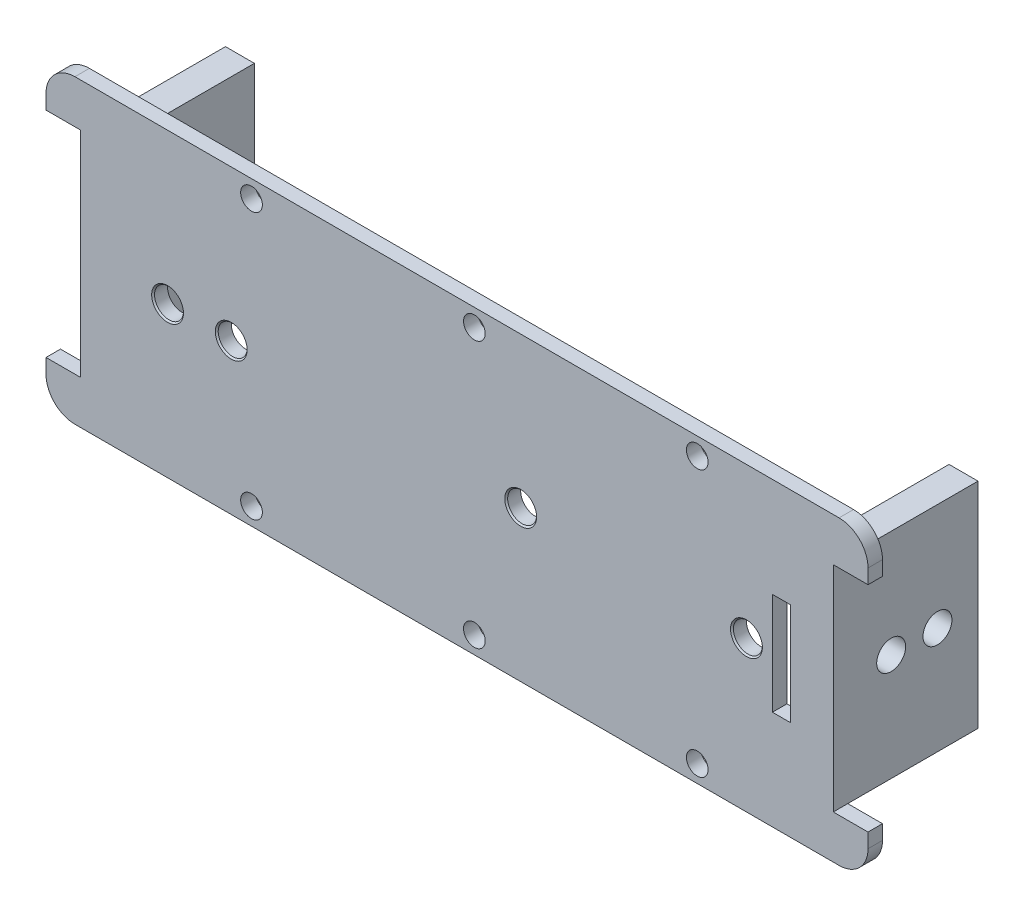
from build123d import *

# Parameters (mm, degrees)
SKETCH1_4_W                            = 360.68
SKETCH1_4_H                            = 132.08
SKETCH1_4_W_2                          = 27.94
SKETCH1_4_H_2                          = 93.98
BOSS_EXTRUDE3_DEPTH                    = 6.35
F_3_8_0_375_DIAMETER_HOLE1_D           = 9.525
F_3_8_0_375_DIAMETER_HOLE1_DEPTH       = 12.7
F_3_8_0_375_DIAMETER_HOLE1_CSINK_D     = 10.795
F_3_8_0_375_DIAMETER_HOLE1_CSINK_ANGLE = 90
F_3_8_0_375_DIAMETER_HOLE1_TIP         = 2.861598698
FILLET1_R                              = 12.7
SKETCH1_W                              = 27.94
SKETCH1_H                              = 93.98
BOSS_EXTRUDE4_DEPTH                    = 63.5
SKETCH10_R                             = 10.16
SKETCH10_R_2                           = 6.35
CUT_EXTRUDE11_DEPTH                    = 386.08
FILLET5_R                              = 6.35
F_1_2_0_5_DIAMETER_HOLE1_D             = 12.7
F_1_2_0_5_DIAMETER_HOLE1_DEPTH         = 13.97
F_1_2_0_5_DIAMETER_HOLE1_CSINK_D       = 13.97
F_1_2_0_5_DIAMETER_HOLE1_CSINK_ANGLE   = 90
F_1_2_0_5_DIAMETER_HOLE1_TIP           = 3.815464931
THREAD15_PITCH                         = 2.116666667
THREAD15_HEIGHT                        = 10
THREAD15_RADIUS                        = 10.16
THREAD15_START_ANGLE                   = -180
SKETCH25_W                             = 7.837170734
SKETCH25_H                             = 44.791396978
CUT_EXTRUDE12_DEPTH                    = 36.068
THREAD16_PITCH                         = 2.116666667
THREAD16_HEIGHT                        = 10
THREAD16_RADIUS                        = 10.16
THREAD16_START_ANGLE                   = -180
BOSS_EXTRUDE6_START                    = -15.24
SKETCH28_R                             = 10.16
BOSS_EXTRUDE6_DEPTH                    = 15.24
SKETCH29_R                             = 10.16
BOSS_EXTRUDE7_DEPTH                    = 15.24
SKETCH30_W                             = 15.24
SKETCH30_H                             = 93.98
CUT_EXTRUDE13_DEPTH                    = 57.15
SKETCH30_2_W                           = 15.24
SKETCH30_2_H                           = 93.98
CUT_EXTRUDE15_DEPTH                    = 139.954
SKETCH33_R                             = 6.35
CUT_EXTRUDE16_DEPTH                    = 343.916


with BuildPart() as part:
    # Sketch1<4> → Boss-Extrude3 (new body)
    with BuildSketch(Plane.XY):
        with Locations((180.34, 66.04)):
            Rectangle(SKETCH1_4_W, SKETCH1_4_H)
        with Locations((346.71, 66.04)):
            Rectangle(SKETCH1_4_W_2, SKETCH1_4_H_2)
    extrude(amount=-BOSS_EXTRUDE3_DEPTH)

    # 3/8 (0.375) Diameter Hole1
    with Locations(Plane.XY.offset(6.35)):
        with Locations((187.96, 124.46), (285.75, 124.46), (90.17, 124.46), (90.17, 7.62), (187.96, 7.62), (285.75, 7.62)):
            CounterSinkHole(F_3_8_0_375_DIAMETER_HOLE1_D / 2, F_3_8_0_375_DIAMETER_HOLE1_CSINK_D / 2, depth=F_3_8_0_375_DIAMETER_HOLE1_DEPTH, counter_sink_angle=F_3_8_0_375_DIAMETER_HOLE1_CSINK_ANGLE)
            with Locations((0, 0, -(F_3_8_0_375_DIAMETER_HOLE1_DEPTH + F_3_8_0_375_DIAMETER_HOLE1_TIP / 2))):  # 118° drill point
                Cone(0, F_3_8_0_375_DIAMETER_HOLE1_D / 2, F_3_8_0_375_DIAMETER_HOLE1_TIP, mode=Mode.SUBTRACT)

    # Fillet1
    fillet1_edges = [part.edges().sort_by_distance(p)[0] for p in [
        (0, 0, -3.175),
        (0, 132.08, -3.175),
        (360.68, 132.08, -3.175),
        (360.68, 0, -3.175),
    ]]
    fillet(fillet1_edges, radius=FILLET1_R)

    # Sketch1 → Boss-Extrude4 (add)
    with BuildSketch(Plane.XY):
        with Locations((346.71, 66.04)):
            Rectangle(SKETCH1_W, SKETCH1_H)
        with Locations((13.97, 66.04)):
            Rectangle(SKETCH1_W, SKETCH1_H)
    extrude(amount=-BOSS_EXTRUDE4_DEPTH)

    # Sketch10 → Cut-Extrude11 (cut)
    with BuildSketch(Plane(origin=(360.68, 0, 0), x_dir=(0, 0, -1), z_dir=(1, 0, 0))):
        with Locations((45.72, 66.04)):
            Circle(SKETCH10_R)
        with Locations((25.4, 66.04)):
            Circle(SKETCH10_R_2)
    extrude(amount=-CUT_EXTRUDE11_DEPTH, mode=Mode.SUBTRACT)

    # Fillet5
    fillet5_edges = [part.edges().sort_by_distance(p)[0] for p in [
        (360.68, 113.03, -34.925),
        (360.68, 66.04, -63.5),
        (360.68, 19.05, -34.925),
        (0, 113.03, -34.925),
        (0, 19.05, -34.925),
        (0, 66.04, -63.5),
    ]]
    fillet(fillet5_edges, radius=FILLET5_R)

    # 1/2 (0.5) Diameter Hole1
    with Locations(Plane.XY):
        with Locations((208.28, 66.04), (81.28, 66.04), (53.34, 66.04), (307.34, 66.04)):
            CounterSinkHole(F_1_2_0_5_DIAMETER_HOLE1_D / 2, F_1_2_0_5_DIAMETER_HOLE1_CSINK_D / 2, depth=F_1_2_0_5_DIAMETER_HOLE1_DEPTH, counter_sink_angle=F_1_2_0_5_DIAMETER_HOLE1_CSINK_ANGLE)
            with Locations((0, 0, -(F_1_2_0_5_DIAMETER_HOLE1_DEPTH + F_1_2_0_5_DIAMETER_HOLE1_TIP / 2))):  # 118° drill point
                Cone(0, F_1_2_0_5_DIAMETER_HOLE1_D / 2, F_1_2_0_5_DIAMETER_HOLE1_TIP, mode=Mode.SUBTRACT)

    # Thread15: sweep along a helix
    with BuildLine() as thread15_path:
        add(Helix(THREAD15_PITCH, THREAD15_HEIGHT, THREAD15_RADIUS, center=(360.68, 66.04, -45.72), direction=(-1, 0, 0), mode=Mode.PRIVATE).rotate(Axis((360.68, 66.04, -45.72), (-1, 0, 0)), THREAD15_START_ANGLE))
    # Thread Profile13 → Thread15 (sweep)
    with BuildSketch(Plane(origin=(360.68, 66.04, -35.56), x_dir=(0, 0, 1), z_dir=(0, -1, 0))):
        Polygon((0, 0), (0, 1.852083328), (-1.145679435, 1.190624997), (-1.145679435, 0.66145833), align=None)
    sweep(path=thread15_path.line, is_frenet=True)

    # Sketch25 → Cut-Extrude12 (cut)
    with BuildSketch(Plane(origin=(0, 0, -6.35), x_dir=(-1, 0, 0), z_dir=(0, 0, -1))):
        with Locations((-322.656094919, 66.002101848)):
            Rectangle(SKETCH25_W, SKETCH25_H)
    extrude(amount=-CUT_EXTRUDE12_DEPTH, mode=Mode.SUBTRACT)

    # Thread16: sweep along a helix
    with BuildLine() as thread16_path:
        add(Helix(THREAD16_PITCH, THREAD16_HEIGHT, THREAD16_RADIUS, center=(0, 66.04, -45.72), direction=(1, 0, 0), mode=Mode.PRIVATE).rotate(Axis((0, 66.04, -45.72), (1, 0, 0)), THREAD16_START_ANGLE))
    # Thread Profile14 → Thread16 (sweep, cut)
    with BuildSketch(Plane(origin=(0, 66.04, -55.88), x_dir=(0, 0, -1), z_dir=(0, -1, 0))):
        Polygon((0, 0), (0, 1.852083328), (-1.145679435, 1.190624997), (-1.145679435, 0.66145833), align=None)
    sweep(path=thread16_path.line, is_frenet=True, mode=Mode.SUBTRACT)

    # Sketch28 → Boss-Extrude6 (add)
    with BuildSketch(Plane.ZY.offset(-332.74).offset(BOSS_EXTRUDE6_START)):
        with Locations((-45.72, 66.04)):
            Circle(SKETCH28_R)
    extrude(amount=BOSS_EXTRUDE6_DEPTH)

    # Sketch29 → Boss-Extrude7 (add)
    with BuildSketch(Plane(origin=(27.94, 0, 0), x_dir=(0, 0, -1), z_dir=(1, 0, 0))):
        with Locations((45.72, 66.04)):
            Circle(SKETCH29_R)
    extrude(amount=-BOSS_EXTRUDE7_DEPTH)

    # Sketch30 → Cut-Extrude13 (cut)
    with BuildSketch(Plane(origin=(0, 0, -63.5), x_dir=(-1, 0, 0), z_dir=(0, 0, -1))):
        with Locations((-353.06, 66.04)):
            Rectangle(SKETCH30_W, SKETCH30_H)
        with Locations((-7.62, 66.04)):
            Rectangle(SKETCH30_W, SKETCH30_H)
    extrude(amount=-CUT_EXTRUDE13_DEPTH, mode=Mode.SUBTRACT)

    # Sketch30<2> → Cut-Extrude15 (cut)
    with BuildSketch(Plane(origin=(0, 0, -63.5), x_dir=(-1, 0, 0), z_dir=(0, 0, -1))):
        with Locations((-353.06, 66.04)):
            Rectangle(SKETCH30_2_W, SKETCH30_2_H)
        with Locations((-7.62, 66.04)):
            Rectangle(SKETCH30_2_W, SKETCH30_2_H)
    extrude(amount=-CUT_EXTRUDE15_DEPTH, mode=Mode.SUBTRACT)

    # Sketch33 → Cut-Extrude16 (cut)
    with BuildSketch(Plane(origin=(345.44, 0, 0), x_dir=(0, 0, -1), z_dir=(1, 0, 0))):
        with Locations(Location((45.72, 66.04, 0), (0, 0, 90))):
            Circle(SKETCH33_R)
    extrude(amount=-CUT_EXTRUDE16_DEPTH, mode=Mode.SUBTRACT)


solid = part.part
